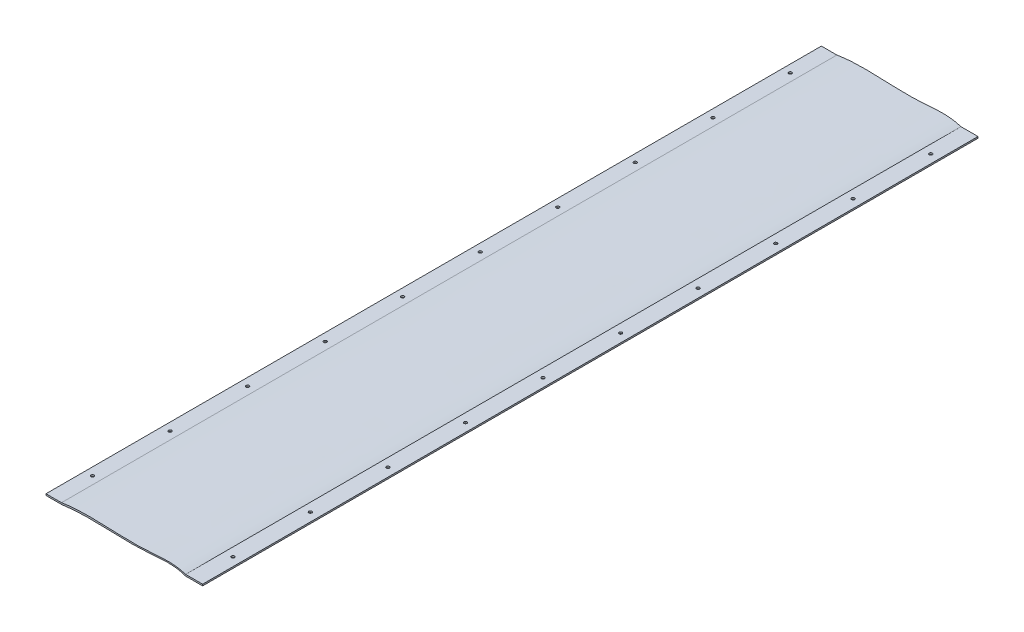
from build123d import *

# Parameters (mm, degrees)
BOSS_EXTRUDE1_DEPTH = 1000
SKETCH2_R           = 2
CUT_EXTRUDE1_DEPTH  = 1000


with BuildPart() as part:
    # Sketch1 → Boss-Extrude1 (new body)
    with BuildSketch(Plane.XY):
        with BuildLine():
            Line((-100, 0), (-100, 2))
            Line((-100, 2), (-80, 2))
            add(Edge.make_bspline(
                [(-80, 2), (-43.592140665, 8.040624859), (9.738592922, -1.468299524), (63.334289404, 7.534924383), (80, 2)],
                knots=[0, 0, 0, 0, 0.681210574, 1, 1, 1, 1], degree=3))
            Line((80, 2), (102, 2))
            Line((102, 2), (102, 0))
            Line((102, 0), (80, 0))
            add(Edge.make_bspline(
                [(-80, 0), (-43.571889954, 5.402355935), (9.739082816, -3.252830544), (63.415202278, 6.17713334), (80, 0)],
                knots=[0, 0, 0, 0, 0.680838855, 1, 1, 1, 1], degree=3))
            Line((-80, 0), (-100, 0))
        make_face()
    extrude(amount=-BOSS_EXTRUDE1_DEPTH)

    # Sketch2 → Cut-Extrude1 (cut)
    with BuildSketch(Plane(origin=(0, 2, 0), x_dir=(1, 0, 0), z_dir=(0, 1, 0))):
        with Locations(Location((91, 950, 0), (0, 0, 180))):
            Circle(SKETCH2_R)
        with Locations(Location((-90, 950, 0), (0, 0, 180))):
            Circle(SKETCH2_R)
        with Locations(Location((91, 850, 0), (0, 0, 180))):
            Circle(SKETCH2_R)
        with Locations(Location((-90, 850, 0), (0, 0, 180))):
            Circle(SKETCH2_R)
        with Locations(Location((91, 750, 0), (0, 0, 180))):
            Circle(SKETCH2_R)
        with Locations(Location((-90, 750, 0), (0, 0, 180))):
            Circle(SKETCH2_R)
        with Locations(Location((91, 650, 0), (0, 0, 180))):
            Circle(SKETCH2_R)
        with Locations(Location((-90, 650, 0), (0, 0, 180))):
            Circle(SKETCH2_R)
        with Locations(Location((91, 550, 0), (0, 0, 180))):
            Circle(SKETCH2_R)
        with Locations(Location((-90, 550, 0), (0, 0, 180))):
            Circle(SKETCH2_R)
        with Locations(Location((91, 450, 0), (0, 0, 180))):
            Circle(SKETCH2_R)
        with Locations(Location((-90, 450, 0), (0, 0, 180))):
            Circle(SKETCH2_R)
        with Locations(Location((91, 350, 0), (0, 0, 180))):
            Circle(SKETCH2_R)
        with Locations(Location((-90, 350, 0), (0, 0, 180))):
            Circle(SKETCH2_R)
        with Locations(Location((91, 250, 0), (0, 0, 180))):
            Circle(SKETCH2_R)
        with Locations(Location((-90, 250, 0), (0, 0, 180))):
            Circle(SKETCH2_R)
        with Locations(Location((91, 150, 0), (0, 0, 180))):
            Circle(SKETCH2_R)
        with Locations(Location((-90, 150, 0), (0, 0, 180))):
            Circle(SKETCH2_R)
        with Locations(Location((91, 50, 0), (0, 0, 180))):
            Circle(SKETCH2_R)
        with Locations(Location((-90, 50, 0), (0, 0, 180))):
            Circle(SKETCH2_R)
    extrude(amount=-CUT_EXTRUDE1_DEPTH, mode=Mode.SUBTRACT)


solid = part.part
